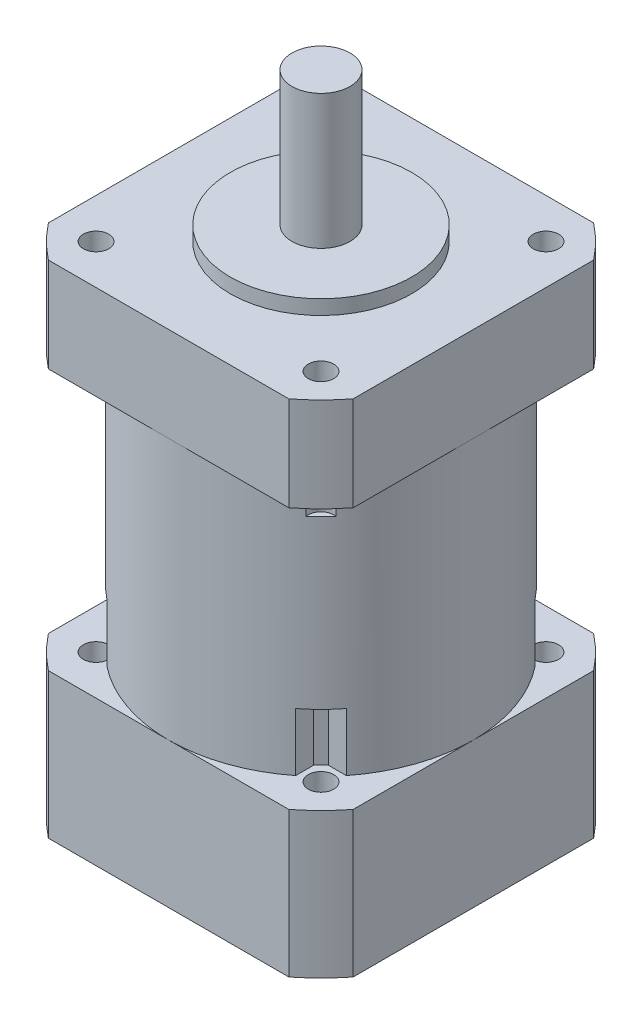
from build123d import *

# Parameters (mm, degrees)
EXTRUDE_1_DEPTH     = 20
SKETCH_2_R          = 21
EXTRUDE_2_DEPTH     = 49
SKETCH_3_R          = 12.5
EXTRUDE_3_DEPTH     = 2
SKETCH_4_R          = 4
EXTRUDE_4_DEPTH     = 18.5
SKETCH_5_R          = 1.75
CUT_EXTRUDE_1_DEPTH = 22.5
SKETCH_6_W          = 5
SKETCH_6_H          = 5
CUT_EXTRUDE_2_DEPTH = 8
CHAMFER_1_SIZE      = 1
SKETCH_7_R          = 12
CUT_EXTRUDE_3_DEPTH = 23
EXTRUDE_5_DEPTH     = 20
EXTRUDE_START       = -13
SKETCH_9_R          = 1.75
SKETCH_9_R_2        = 12
EXTRUDE_6_DEPTH     = 13
CUT_EXTRUDE_START   = -18
SKETCH_10_R         = 1.75
CUT_EXTRUDE_4_DEPTH = 18


with BuildPart() as part:
    # 草图1 → 凸台-拉伸1 (new body)
    with BuildSketch(Plane(origin=(0, 0, 0), x_dir=(1, 0, 0), z_dir=(0, 1, 0))):
        with BuildLine():
            Line((16.56992758, 21), (-16.56992758, 21))
            ThreePointArc((-16.56992758, 21), (-18.915106397, 18.915106397), (-21, 16.56992758))
            Line((-21, 16.56992758), (-21, -16.56992758))
            ThreePointArc((-21, -16.56992758), (-18.915106397, -18.915106397), (-16.56992758, -21))
            Line((-16.56992758, -21), (16.56992758, -21))
            ThreePointArc((16.56992758, -21), (18.915106397, -18.915106397), (21, -16.56992758))
            Line((21, -16.56992758), (21, 16.56992758))
            ThreePointArc((21, 16.56992758), (18.915106397, 18.915106397), (16.56992758, 21))
        make_face()
    extrude(amount=EXTRUDE_1_DEPTH)

    # 草图2 → 凸台-拉伸2 (add)
    with BuildSketch(Plane(origin=(0, 20, 0), x_dir=(1, 0, 0), z_dir=(0, 1, 0))):
        with Locations(Location((0, 0, 0), (0, 0, 270))):
            Circle(SKETCH_2_R)
    extrude(amount=EXTRUDE_2_DEPTH)

    # 草图3 → 凸台-拉伸3 (add)
    with BuildSketch(Plane(origin=(0, 69, 0), x_dir=(1, 0, 0), z_dir=(0, 1, 0))):
        with Locations(Location((0, 0, 0), (0, 0, 270))):
            Circle(SKETCH_3_R)
    extrude(amount=EXTRUDE_3_DEPTH)

    # 草图4 → 凸台-拉伸4 (add)
    with BuildSketch(Plane(origin=(0, 71, 0), x_dir=(1, 0, 0), z_dir=(0, 1, 0))):
        with Locations(Location((0, 0, 0), (0, 0, 270))):
            Circle(SKETCH_4_R)
    extrude(amount=EXTRUDE_4_DEPTH)

    # 草图5 → 切除-拉伸1 (cut)
    with BuildSketch(Plane.XZ):
        with Locations(Location((15.5, 15.5, 0), (0, 0, 270))):
            Circle(SKETCH_5_R)
        with Locations(Location((15.5, -15.5, 0), (0, 0, 270))):
            Circle(SKETCH_5_R)
        with Locations(Location((-15.5, -15.5, 0), (0, 0, 270))):
            Circle(SKETCH_5_R)
        with Locations(Location((-15.5, 15.5, 0), (0, 0, 270))):
            Circle(SKETCH_5_R)
    extrude(amount=-CUT_EXTRUDE_1_DEPTH, mode=Mode.SUBTRACT)

    # 草图6 → 切除-拉伸2 (cut)
    with BuildSketch(Plane(origin=(0, 20, 0), x_dir=(1, 0, 0), z_dir=(0, 1, 0))):
        with Locations((-15.5, -15.5)):
            Rectangle(SKETCH_6_W, SKETCH_6_H)
        with Locations((15.5, -15.5)):
            Rectangle(SKETCH_6_W, SKETCH_6_H)
        with Locations((-15.5, 15.5)):
            Rectangle(SKETCH_6_W, SKETCH_6_H)
        with Locations((15.5, 15.5)):
            Rectangle(SKETCH_6_W, SKETCH_6_H)
    extrude(amount=CUT_EXTRUDE_2_DEPTH, mode=Mode.SUBTRACT)

    # 倒角1
    chamfer_1_edges = [part.edges().sort_by_distance(p)[0] for p in [
        (13, 24, -13),
        (-13, 24, -13),
        (-13, 24, 13),
        (13, 24, 13),
    ]]
    chamfer(chamfer_1_edges, length=CHAMFER_1_SIZE)

    # 草图7 → 切除-拉伸3 (cut)
    with BuildSketch(Plane.XZ):
        with Locations(Location((0, 0, 0), (0, 0, 270))):
            Circle(SKETCH_7_R)
    extrude(amount=-CUT_EXTRUDE_3_DEPTH, mode=Mode.SUBTRACT)

    # 草图8 → 凸台-拉伸5 (add)
    with BuildSketch(Plane.XZ.offset(-23)):
        with BuildLine():
            ThreePointArc((2.1, 0), (-1.29614814, -1.652271164), (-0.5, 2.039607805))
            Line((-0.5, 2.039607805), (-0.5, 10.988630488))
            ThreePointArc((-0.5, 10.988630488), (-7.599342077, -7.95298686), (11, 0))
            ThreePointArc((11, 0), (7.95298686, 7.599342077), (0.5, 10.988630488))
            Line((0.5, 10.988630488), (0.5, 2.039607805))
            ThreePointArc((0.5, 2.039607805), (1.652271164, 1.29614814), (2.1, 0))
        make_face()
    extrude(amount=EXTRUDE_5_DEPTH)

    # 草图9 → 凸台-拉伸6 (add)
    with BuildSketch(Plane(origin=(0, 69, 0), x_dir=(1, 0, 0), z_dir=(0, 1, 0)).offset(EXTRUDE_START)):
        with BuildLine():
            Line((-16.56992758, -21), (16.56992758, -21))
            ThreePointArc((16.56992758, -21), (18.915106397, -18.915106397), (21, -16.56992758))
            Line((21, -16.56992758), (21, 16.56992758))
            ThreePointArc((21, 16.56992758), (18.915106397, 18.915106397), (16.56992758, 21))
            Line((16.56992758, 21), (-16.56992758, 21))
            ThreePointArc((-16.56992758, 21), (-18.915106397, 18.915106397), (-21, 16.56992758))
            Line((-21, 16.56992758), (-21, -16.56992758))
            ThreePointArc((-21, -16.56992758), (-18.915106397, -18.915106397), (-16.56992758, -21))
        make_face()
        with Locations(Location((15.5, 15.5, 0), (0, 0, 90))):
            Circle(SKETCH_9_R, mode=Mode.SUBTRACT)
        with Locations(Location((15.5, -15.5, 0), (0, 0, 90))):
            Circle(SKETCH_9_R, mode=Mode.SUBTRACT)
        with Locations(Location((-15.5, 15.5, 0), (0, 0, 90))):
            Circle(SKETCH_9_R, mode=Mode.SUBTRACT)
        with Locations(Location((-15.5, -15.5, 0), (0, 0, 90))):
            Circle(SKETCH_9_R, mode=Mode.SUBTRACT)
        with Locations(Location((0, 0, 0), (0, 0, 90))):
            Circle(SKETCH_9_R_2, mode=Mode.SUBTRACT)
    extrude(amount=EXTRUDE_6_DEPTH)

    # 草图10 → 切除-拉伸4 (cut)
    with BuildSketch(Plane(origin=(0, 69, 0), x_dir=(1, 0, 0), z_dir=(0, 1, 0)).offset(CUT_EXTRUDE_START)):
        with Locations(Location((15.5, -15.5, 0), (0, 0, 90))):
            Circle(SKETCH_10_R)
        with Locations(Location((-15.5, -15.5, 0), (0, 0, 90))):
            Circle(SKETCH_10_R)
        with Locations(Location((-15.5, 15.5, 0), (0, 0, 90))):
            Circle(SKETCH_10_R)
        with Locations(Location((15.5, 15.5, 0), (0, 0, 90))):
            Circle(SKETCH_10_R)
    extrude(amount=CUT_EXTRUDE_4_DEPTH, mode=Mode.SUBTRACT)


solid = part.part
